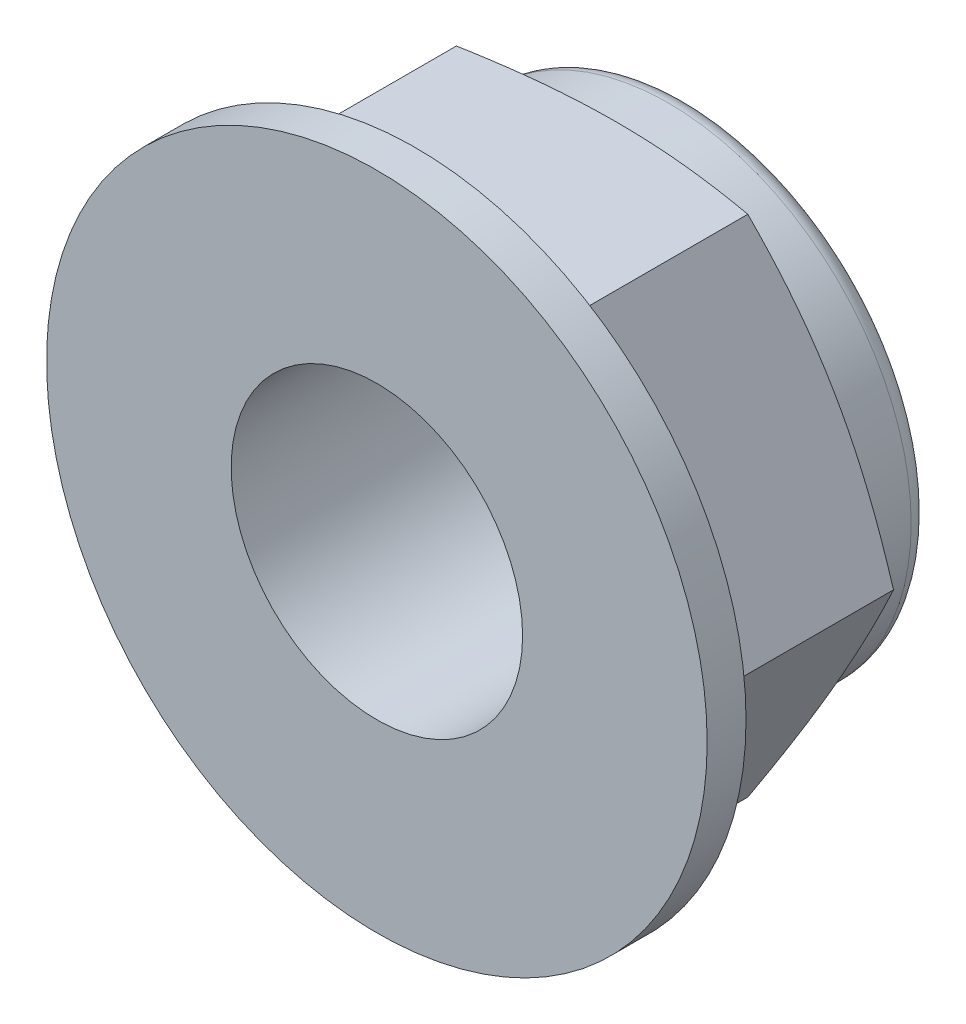
from build123d import *

# Parameters (mm, degrees)
CUT_EXTRUDE_2_DEPTH = 2.729
CUT_EXTRUDE_3_DEPTH = 2.729
CUT_EXTRUDE_8_DEPTH = 2.729
CUT_EXTRUDE_7_DEPTH = 2.729
SKETCH_11_R         = 2
SKETCH_11_R_2       = 1.5
EXTRUDE_3_DEPTH     = 0.7
CUT_EXTRUDE_9_DEPTH = 2.729


with BuildPart() as part:
    # 草图2 → 旋转2 (revolve)
    with BuildSketch(Plane(origin=(0, 0, 0), x_dir=(0, 0, -1), z_dir=(1, 0, 0)), mode=Mode.PRIVATE) as revolve_2_sk:
        with BuildLine():
            Line((0, 1.5), (0, 3.4))
            Line((0, 3.4), (0.4, 3.4))
            Line((0.4, 3.4), (0.470530792, 3))
            Line((0.470530792, 3), (2.318014883, 3))
            Line((2.318014883, 3), (2.5, 2.5))
            Line((2.5, 2.5), (3, 2.5))
            ThreePointArc((3, 2.5), (3.141421356, 2.441421356), (3.2, 2.3))
            Line((3.2, 2.3), (3.2, 2))
            Line((3.2, 2), (2.5, 2))
            Line((2.5, 2), (2.5, 1.5))
            Line((2.5, 1.5), (0, 1.5))
        make_face()
    revolve(revolve_2_sk.sketch.rotate(Axis((0, 0, 0), (0, 0, -1)), 90), axis=Axis((0, 0, 0), (0, 0, -1)))

    # 草图10 → 切除-拉伸2 (cut)
    with BuildSketch(Plane(origin=(0, 0, -3.2), x_dir=(-1, 0, 0), z_dir=(0, 0, -1))):
        with BuildLine():
            Line((-3, 0), (-1.5, 2.598076211))
            ThreePointArc((-1.5, 2.598076211), (-2.598076211, 1.5), (-3, 0))
        make_face()
    extrude(amount=-CUT_EXTRUDE_2_DEPTH, mode=Mode.SUBTRACT)

    # 草图10<4> → 切除-拉伸3 (cut)
    with BuildSketch(Plane(origin=(0, 0, -3.2), x_dir=(-1, 0, 0), z_dir=(0, 0, -1))):
        with BuildLine():
            Line((-1.5, -2.598076211), (-3, 0))
            ThreePointArc((-3, 0), (-2.598076211, -1.5), (-1.5, -2.598076211))
        make_face()
    extrude(amount=-CUT_EXTRUDE_3_DEPTH, mode=Mode.SUBTRACT)

    # 草图10<8> → 切除-拉伸8 (cut)
    with BuildSketch(Plane(origin=(0, 0, -3.2), x_dir=(-1, 0, 0), z_dir=(0, 0, -1))):
        with BuildLine():
            ThreePointArc((1.5, 2.598076211), (0, 3), (-1.5, 2.598076211))
            Line((-1.5, 2.598076211), (1.5, 2.598076211))
        make_face()
    extrude(amount=-CUT_EXTRUDE_8_DEPTH, mode=Mode.SUBTRACT)

    # 草图10<7> → 切除-拉伸7 (cut)
    with BuildSketch(Plane(origin=(0, 0, -3.2), x_dir=(-1, 0, 0), z_dir=(0, 0, -1))):
        with BuildLine():
            ThreePointArc((1.5, 2.598076211), (0, 3), (-1.5, 2.598076211))
            Line((-1.5, 2.598076211), (1.5, 2.598076211))
        make_face()
        with BuildLine():
            ThreePointArc((3, 0), (2.598076211, 1.5), (1.5, 2.598076211))
            Line((1.5, 2.598076211), (3, 0))
        make_face()
        with BuildLine():
            ThreePointArc((1.5, -2.598076211), (2.598076211, -1.5), (3, 0))
            Line((3, 0), (1.5, -2.598076211))
        make_face()
    extrude(amount=-CUT_EXTRUDE_7_DEPTH, mode=Mode.SUBTRACT)

    # 草图10<9> → 切除-拉伸9 (cut)
    with BuildSketch(Plane(origin=(0, 0, -3.2), x_dir=(-1, 0, 0), z_dir=(0, 0, -1))):
        with BuildLine():
            Line((1.5, -2.598076211), (-1.5, -2.598076211))
            ThreePointArc((-1.5, -2.598076211), (0, -3), (1.5, -2.598076211))
        make_face()
    extrude(amount=-CUT_EXTRUDE_9_DEPTH, mode=Mode.SUBTRACT)


with BuildPart() as body_2:
    # 草图11 → 凸台-拉伸3 (new body)
    with BuildSketch(Plane(origin=(0, 0, -2.5), x_dir=(-1, 0, 0), z_dir=(0, 0, -1))):
        with Locations(Location((0, 0, 0), (0, 0, 180))):
            Circle(SKETCH_11_R)
        with Locations(Location((0, 0, 0), (0, 0, 180))):
            Circle(SKETCH_11_R_2, mode=Mode.SUBTRACT)
    extrude(amount=EXTRUDE_3_DEPTH)


solid = Compound([part.part, body_2.part])
